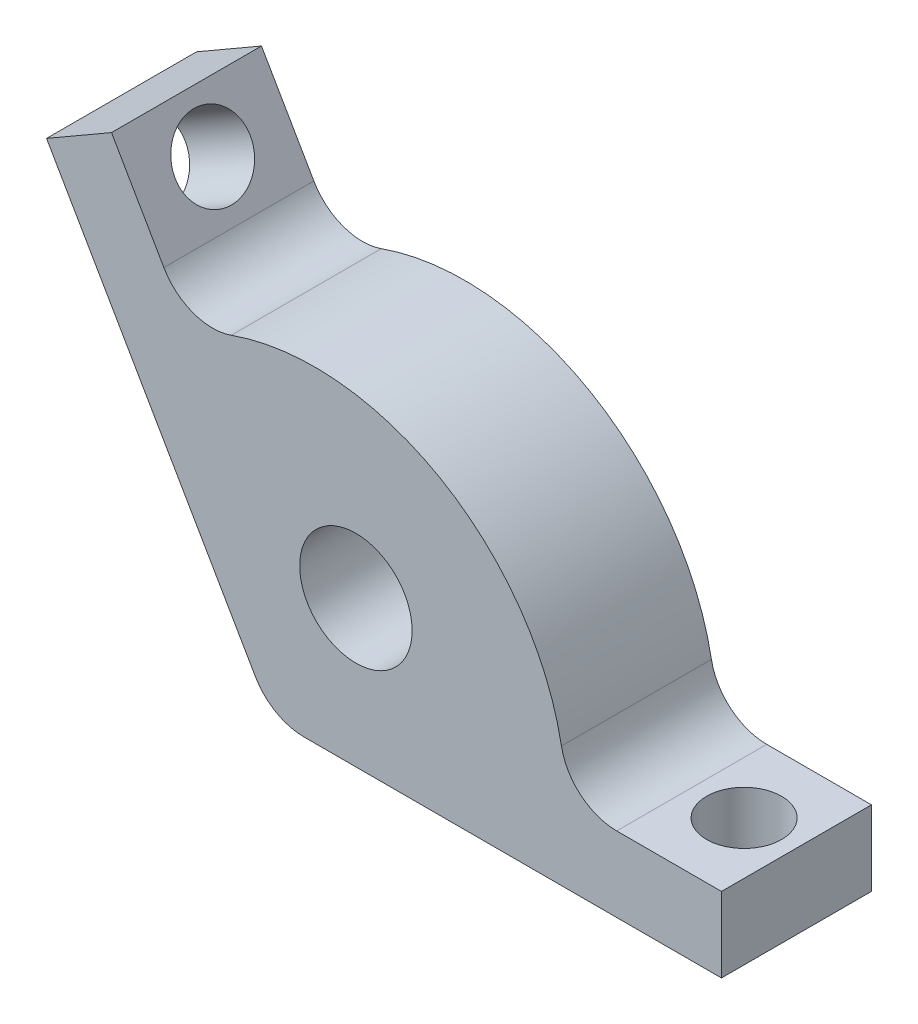
from build123d import *

# Parameters (mm, degrees)
SKETCH1_R           = 2.38125
BOSS_EXTRUDE1_DEPTH = 6.35
FILLET1_R           = 2.38125
SKETCH2_R           = 1.5875
CUT_EXTRUDE1_DEPTH  = 26.010828999
CIRPATTERN1_COUNT   = 3


with BuildPart() as part:
    # Sketch1 → Boss-Extrude1 (new body)
    with BuildSketch(Plane.XY):
        with BuildLine():
            Line((0, 0), (19.05, 0))
            Line((19.05, 0), (19.05, 3.175))
            Line((19.05, 3.175), (12.454412895, 3.175))
            ThreePointArc((12.454412895, 3.175), (7.14375, 12.373337957), (-3.477575791, 12.373337957))
            Line((-3.477575791, 12.373337957), (-6.775369343, 18.085283942))
            Line((-6.775369343, 18.085283942), (-9.525, 16.497783942))
            Line((-9.525, 16.497783942), (0, 0))
        make_face()
        with Locations((3.571875, 6.186668978)):
            Circle(SKETCH1_R, mode=Mode.SUBTRACT)
    extrude(amount=BOSS_EXTRUDE1_DEPTH)

    # Fillet1
    fillet1_edges = [part.edges().sort_by_distance(p)[0] for p in [
        (-3.477575791, 12.373337957, 3.175),
        (12.454412895, 3.175, 3.175),
        (0, 0, 3.175),
    ]]
    fillet(fillet1_edges, radius=FILLET1_R)

    # Sketch2 → Cut-Extrude1 (cut, through all)
    with BuildSketch(Plane(origin=(0, 3.175, 0), x_dir=(1, 0, 0), z_dir=(0, 1, 0))):
        with Locations(Location((16.83287803, -3.175, 0), (0, 0, 180))):
            Circle(SKETCH2_R)
    cut_extrude1 = extrude(amount=-CUT_EXTRUDE1_DEPTH, mode=Mode.SUBTRACT)

    # CirPattern1: Cut-Extrude1 ×3 about axis
    cirpattern1_axis = Axis((0, 0, -80.9), (0, 0, 1))
    for i in range(1, CIRPATTERN1_COUNT):
        add(cut_extrude1.rotate(cirpattern1_axis, i * 360 / CIRPATTERN1_COUNT), mode=Mode.SUBTRACT)


solid = part.part
